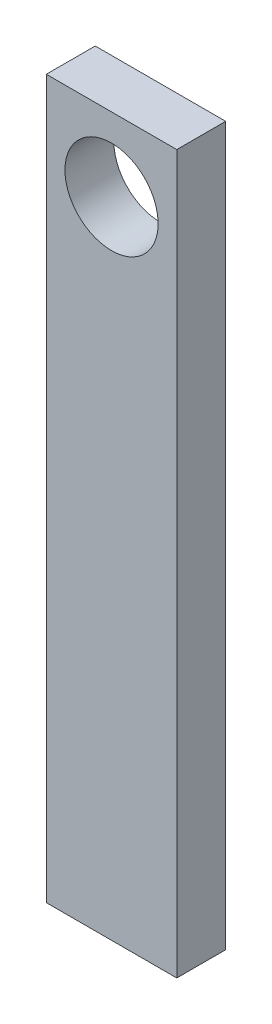
from build123d import *

# Parameters (mm, degrees)
BOSS_EXTRUDE1_DEPTH      = 20
BOSS_EXTRUDE1_DEPTH_BACK = 20
SKETCH1_W                = 15
SKETCH1_H                = 220
CUT_EXTRUDE1_REACH       = 193.638
SKETCH5_R                = 14.2875


with BuildPart() as part:
    # Sketch1 → Boss-Extrude1 (new, two sides: drawn at the far end of the back side and taken through both)
    with BuildSketch(Plane.ZY.offset(-BOSS_EXTRUDE1_DEPTH_BACK)):
        with Locations((-7.5, 80)):
            Rectangle(SKETCH1_W, SKETCH1_H)
    extrude(amount=BOSS_EXTRUDE1_DEPTH + BOSS_EXTRUDE1_DEPTH_BACK)

    # Sketch5 → Cut-Extrude1 (cut, up to next)
    with BuildSketch(Plane(origin=(0, 0, -15), x_dir=(-1, 0, 0), z_dir=(0, 0, -1)), mode=Mode.PRIVATE) as cut_extrude1_sk1:
        with Locations((0, 167.443589791)):
            Circle(SKETCH5_R)
    cut_extrude1_tool1 = extrude(cut_extrude1_sk1.sketch, amount=-CUT_EXTRUDE1_REACH, mode=Mode.PRIVATE) & part.part
    add(cut_extrude1_tool1.solids().sort_by_distance((0, 167.44359, -15))[0], mode=Mode.SUBTRACT)


solid = part.part
